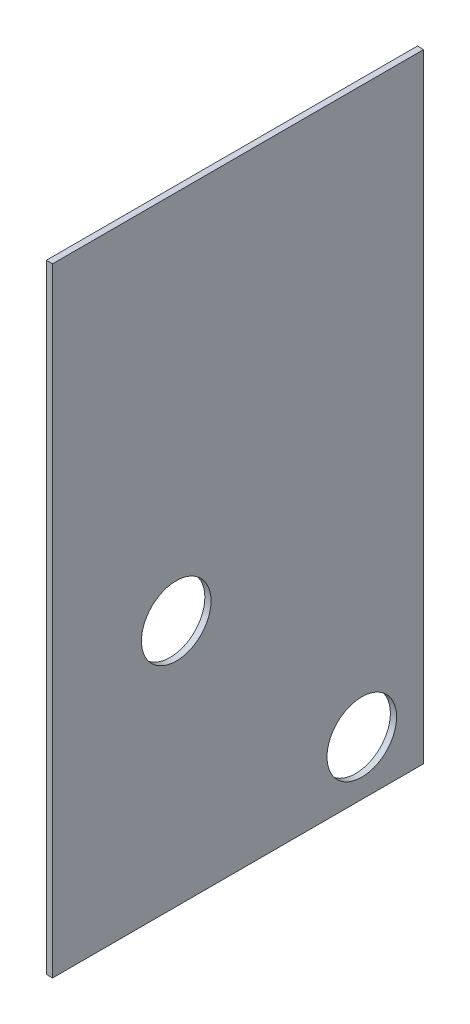
from build123d import *

# Parameters (mm, degrees)
SKETCH1_W                       = 152.4
SKETCH1_H                       = 254
BOSS_EXTRUDE1_DEPTH             = 1.27
SKETCH2_R                       = 14.2875
UPPER_INTAKE_BEARING_HOLE_DEPTH = 2.54
SKETCH3_R                       = 14.2875
LOWER_INTAKE_BEARING_HOLE_DEPTH = 2.54


with BuildPart() as part:
    # Sketch1 → Boss-Extrude1 (new, symmetric)
    with BuildSketch(Plane(origin=(0, 0, 0), x_dir=(0, 0, -1), z_dir=(1, 0, 0))):
        Rectangle(SKETCH1_W, SKETCH1_H)
    extrude(amount=BOSS_EXTRUDE1_DEPTH, both=True)

    # Sketch2 → upper intake bearing hole (cut)
    with BuildSketch(Plane(origin=(1.27, 0, 0), x_dir=(0, 0, -1), z_dir=(1, 0, 0))):
        with Locations((-25.4, -25.4)):
            Circle(SKETCH2_R)
    extrude(amount=-UPPER_INTAKE_BEARING_HOLE_DEPTH, mode=Mode.SUBTRACT)

    # Sketch3 → lower intake bearing hole (cut)
    with BuildSketch(Plane(origin=(1.27, 0, 0), x_dir=(0, 0, -1), z_dir=(1, 0, 0))):
        with Locations((50.8, -104.775)):
            Circle(SKETCH3_R)
    extrude(amount=-LOWER_INTAKE_BEARING_HOLE_DEPTH, mode=Mode.SUBTRACT)


solid = part.part
